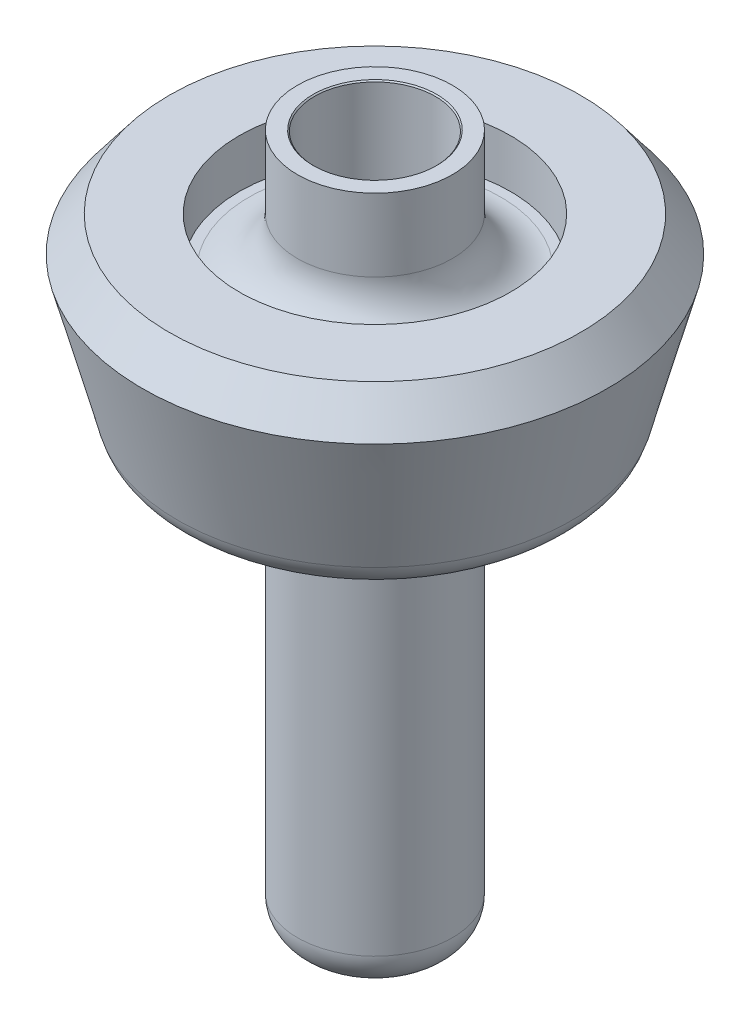
from build123d import *

# Parameters (mm, degrees)
FILLET1_R                       = 1
F_2_5MM_DOWEL_HOLE1_D           = 2.5
F_2_5MM_DOWEL_HOLE1_DEPTH       = 5.5
F_2_5MM_DOWEL_HOLE1_CSINK_D     = 2.55
F_2_5MM_DOWEL_HOLE1_CSINK_ANGLE = 90
F_2_5MM_DOWEL_HOLE1_TIP         = 0.751075774


with BuildPart() as part:
    # Sketch1 → Revolve1 (revolve)
    with BuildSketch(Plane.XY, mode=Mode.PRIVATE) as revolve1_sk:
        with BuildLine():
            Line((1.6, 15), (1.6, 12.5))
            Line((1.6, 12.5), (2.8, 12.5))
            Line((2.8, 12.5), (2.8, 13.5))
            Line((2.8, 13.5), (4.244114284, 13.5))
            Line((4.244114284, 13.5), (4.8, 12.77555563))
            Line((4.8, 12.77555563), (4.071266643, 10.055885716))
            ThreePointArc((4.071266643, 10.055885716), (3.803393345, 9.654984995), (3.346822273, 9.5))
            Line((3.346822273, 9.5), (2.35, 9.5))
            ThreePointArc((2.35, 9.5), (1.819669914, 9.280330086), (1.6, 8.75))
            Line((1.6, 8.75), (1.6, 1.356773133))
            ThreePointArc((1.6, 1.356773133), (1.499519053, 0.981773133), (1.225, 0.70725408))
            Line((1.225, 0.70725408), (0.258564065, 0.149282032))
            ThreePointArc((0.258564065, 0.149282032), (0.133842609, 0.097620714), (0, 0.08))
            Line((0, 0.08), (0, 15))
            Line((0, 15), (1.6, 15))
        make_face()
    revolve(revolve1_sk.sketch.rotate(Axis((0, 17.798555487, 0), (0, -1, 0)), 180), axis=Axis((0, 17.798555487, 0), (0, -1, 0)))

    # Fillet1
    fillet1_edges = [part.edges().sort_by_distance(p)[0] for p in [
        (1.6, 12.5, 0),
    ]]
    fillet(fillet1_edges, radius=FILLET1_R)

    # Ø2.5mm Dowel Hole1
    with Locations(Plane(origin=(0, 15, 0), x_dir=(1, 0, 0), z_dir=(0, 1, 0))):
        with Locations((0, 0)):
            CounterSinkHole(F_2_5MM_DOWEL_HOLE1_D / 2, F_2_5MM_DOWEL_HOLE1_CSINK_D / 2, depth=F_2_5MM_DOWEL_HOLE1_DEPTH, counter_sink_angle=F_2_5MM_DOWEL_HOLE1_CSINK_ANGLE)
            with Locations((0, 0, -(F_2_5MM_DOWEL_HOLE1_DEPTH + F_2_5MM_DOWEL_HOLE1_TIP / 2))):  # 118° drill point
                Cone(0, F_2_5MM_DOWEL_HOLE1_D / 2, F_2_5MM_DOWEL_HOLE1_TIP, mode=Mode.SUBTRACT)


solid = part.part
